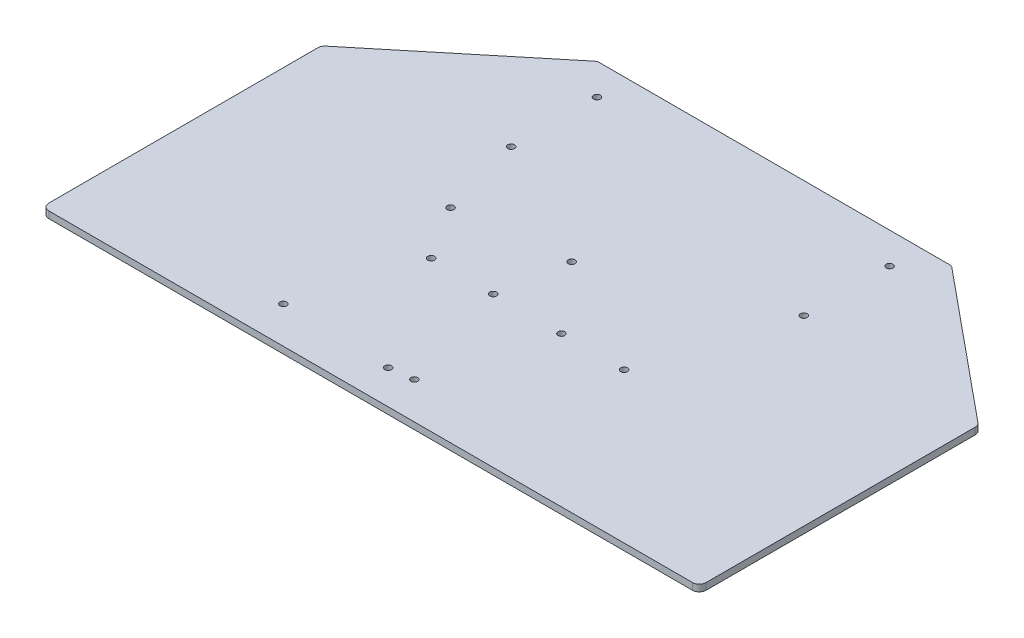
from build123d import *

# Parameters (mm, degrees)
SKETCH1_W               = 297
SKETCH1_H               = 210
BOSS_EXTRUDE1_DEPTH     = 3
SKETCH2_OUTSIDE_W       = 371.752
SKETCH2_OUTSIDE_H       = 284.752
SKETCH2_OUTSIDE_R       = 1.5
LASER_CUT_PROFILE_DEPTH = 364.755412331


with BuildPart() as part:
    # Sketch1 → Boss-Extrude1 (new body)
    with BuildSketch(Plane(origin=(0, 0, 0), x_dir=(1, 0, 0), z_dir=(0, 1, 0))):
        with Locations((148.5, 105)):
            Rectangle(SKETCH1_W, SKETCH1_H)
    extrude(amount=BOSS_EXTRUDE1_DEPTH)

    # Sketch2 outside → Laser Cut Profile (cut, through all)
    # profile 1 of 14: a face of its own
    with BuildSketch(Plane(origin=(0, 3, 0), x_dir=(1, 0, 0), z_dir=(0, 1, 0))):
        with Locations((148.5, 105)):
            Rectangle(SKETCH2_OUTSIDE_W, SKETCH2_OUTSIDE_H)
        with BuildLine():
            Line((5, 2), (292, 2))
            ThreePointArc((292, 2), (294.121320344, 2.878679656), (295, 5))
            Line((295, 5), (295, 125))
            ThreePointArc((295, 125), (294.712859503, 126.280778403), (293.906404455, 127.316381241))
            Line((293.906404455, 127.316381241), (228.29357677, 181.316381241))
            ThreePointArc((228.29357677, 181.316381241), (227.399806572, 181.823928445), (226.387172315, 182))
            Line((226.387172315, 182), (70.612827685, 182))
            ThreePointArc((70.612827685, 182), (69.600193428, 181.823928445), (68.70642323, 181.316381241))
            Line((68.70642323, 181.316381241), (3.093595545, 127.316381241))
            ThreePointArc((3.093595545, 127.316381241), (2.287140497, 126.280778403), (2, 125))
            Line((2, 125), (2, 5))
            ThreePointArc((2, 5), (2.878679656, 2.878679656), (5, 2))
        make_face(mode=Mode.SUBTRACT)
    # profile 2 of 14: a face of its own
    with BuildSketch(Plane(origin=(0, 3, 0), x_dir=(1, 0, 0), z_dir=(0, 1, 0))):
        with Locations(Location((93.3, 92.8, 0), (0, 0, 270))):
            Circle(SKETCH2_OUTSIDE_R)
    # profile 3 of 14: a face of its own
    with BuildSketch(Plane(origin=(0, 3, 0), x_dir=(1, 0, 0), z_dir=(0, 1, 0))):
        with Locations(Location((141.2, 98.9, 0), (0, 0, 270))):
            Circle(SKETCH2_OUTSIDE_R)
    # profile 4 of 14: a face of its own
    with BuildSketch(Plane(origin=(0, 3, 0), x_dir=(1, 0, 0), z_dir=(0, 1, 0))):
        with Locations(Location((136.2, 68.95, 0), (0, 0, 270))):
            Circle(SKETCH2_OUTSIDE_R)
    # profile 5 of 14: a face of its own
    with BuildSketch(Plane(origin=(0, 3, 0), x_dir=(1, 0, 0), z_dir=(0, 1, 0))):
        with Locations(Location((108.5, 68.95, 0), (0, 0, 270))):
            Circle(SKETCH2_OUTSIDE_R)
    # profile 6 of 14: a face of its own
    with BuildSketch(Plane(origin=(0, 3, 0), x_dir=(1, 0, 0), z_dir=(0, 1, 0))):
        with Locations(Location((93.2, 18.35, 0), (0, 0, 270))):
            Circle(SKETCH2_OUTSIDE_R)
    # profile 7 of 14: a face of its own
    with BuildSketch(Plane(origin=(0, 3, 0), x_dir=(1, 0, 0), z_dir=(0, 1, 0))):
        with Locations(Location((141.2, 17.1, 0), (0, 0, 270))):
            Circle(SKETCH2_OUTSIDE_R)
    # profile 8 of 14: a face of its own
    with BuildSketch(Plane(origin=(0, 3, 0), x_dir=(1, 0, 0), z_dir=(0, 1, 0))):
        with Locations(Location((151.6, 18.4, 0), (0, 0, 270))):
            Circle(SKETCH2_OUTSIDE_R)
    # profile 9 of 14: a face of its own
    with BuildSketch(Plane(origin=(0, 3, 0), x_dir=(1, 0, 0), z_dir=(0, 1, 0))):
        with Locations(Location((166.65, 68.9, 0), (0, 0, 270))):
            Circle(SKETCH2_OUTSIDE_R)
    # profile 10 of 14: a face of its own
    with BuildSketch(Plane(origin=(0, 3, 0), x_dir=(1, 0, 0), z_dir=(0, 1, 0))):
        with Locations(Location((194.6, 68.9, 0), (0, 0, 270))):
            Circle(SKETCH2_OUTSIDE_R)
    # profile 11 of 14: a face of its own
    with BuildSketch(Plane(origin=(0, 3, 0), x_dir=(1, 0, 0), z_dir=(0, 1, 0))):
        with Locations(Location((83.275, 129.849046067, 0), (0, 0, 270))):
            Circle(SKETCH2_OUTSIDE_R)
    # profile 12 of 14: a face of its own
    with BuildSketch(Plane(origin=(0, 3, 0), x_dir=(1, 0, 0), z_dir=(0, 1, 0))):
        with Locations(Location((213.725, 129.849046067, 0), (0, 0, 270))):
            Circle(SKETCH2_OUTSIDE_R)
    # profile 13 of 14: a face of its own
    with BuildSketch(Plane(origin=(0, 3, 0), x_dir=(1, 0, 0), z_dir=(0, 1, 0))):
        with Locations(Location((83.275, 168.099046067, 0), (0, 0, 270))):
            Circle(SKETCH2_OUTSIDE_R)
    # profile 14 of 14: a face of its own
    with BuildSketch(Plane(origin=(0, 3, 0), x_dir=(1, 0, 0), z_dir=(0, 1, 0))):
        with Locations(Location((213.725, 168.099046067, 0), (0, 0, 270))):
            Circle(SKETCH2_OUTSIDE_R)
    extrude(amount=-LASER_CUT_PROFILE_DEPTH, mode=Mode.SUBTRACT)


solid = part.part
